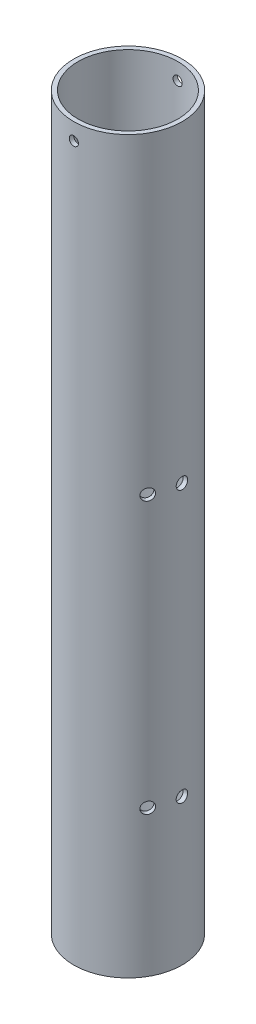
from build123d import *

# Parameters (mm, degrees)
SKETCH1_R               = 26
SKETCH1_R_2             = 23.9
BOSS_EXTRUDE1_DEPTH     = 350
SKETCH3_R               = 2.75
CUT_EXTRUDE2_DEPTH      = 352.926128612
CIRPATTERN1_COUNT       = 3
CUT_EXTRUDE3_DEPTH      = 352.926128726
CUT_EXTRUDE3_DEPTH_BACK = 352.926128726
SKETCH5_R               = 2.75
CUT_EXTRUDE4_DEPTH      = 352.926128726
CUT_EXTRUDE4_DEPTH_BACK = 352.926128726
SKETCH6_R               = 2.194915


with BuildPart() as part:
    # Sketch1 → Boss-Extrude1 (new body)
    with BuildSketch(Plane(origin=(0, 0, 0), x_dir=(1, 0, 0), z_dir=(0, 1, 0))):
        with Locations(Location((0, 0, 0), (0, 0, 270))):
            Circle(SKETCH1_R)
        with Locations(Location((0, 0, 0), (0, 0, 270))):
            Circle(SKETCH1_R_2, mode=Mode.SUBTRACT)
    extrude(amount=BOSS_EXTRUDE1_DEPTH)

    # Sketch3 → Cut-Extrude2 (cut, through all)
    with BuildSketch(Plane.XY):
        with Locations(Location((0, 70, 0), (0, 0, 90))):
            Circle(SKETCH3_R)
        with Locations(Location((0, 200, 0), (0, 0, 90))):
            Circle(SKETCH3_R)
    cut_extrude2 = extrude(amount=-CUT_EXTRUDE2_DEPTH, mode=Mode.SUBTRACT)

    # CirPattern1: Cut-Extrude2 ×3 about axis
    cirpattern1_axis = Axis((0, 350, 0), (0, -1, 0))
    for i in range(1, CIRPATTERN1_COUNT):
        add(cut_extrude2.rotate(cirpattern1_axis, i * 360 / CIRPATTERN1_COUNT), mode=Mode.SUBTRACT)

    # Sketch5 → Cut-Extrude3 (cut, two sides: drawn at the far end of the back side and taken through both)
    with BuildSketch(Plane(origin=(0, 0, 0), x_dir=(0, 0, -1), z_dir=(1, 0, 0)).offset(-CUT_EXTRUDE3_DEPTH_BACK)):
        with Locations((0, 200)):
            Circle(SKETCH5_R)
        with Locations((0, 70)):
            Circle(SKETCH5_R)
    extrude(amount=CUT_EXTRUDE3_DEPTH + CUT_EXTRUDE3_DEPTH_BACK, mode=Mode.SUBTRACT)

    # Sketch6 → Cut-Extrude4 (cut, two sides: drawn at the far end of the back side and taken through both)
    with BuildSketch(Plane.XY.offset(-CUT_EXTRUDE4_DEPTH_BACK)):
        with Locations((0, 342)):
            Circle(SKETCH6_R)
    extrude(amount=CUT_EXTRUDE4_DEPTH + CUT_EXTRUDE4_DEPTH_BACK, mode=Mode.SUBTRACT)


solid = part.part
